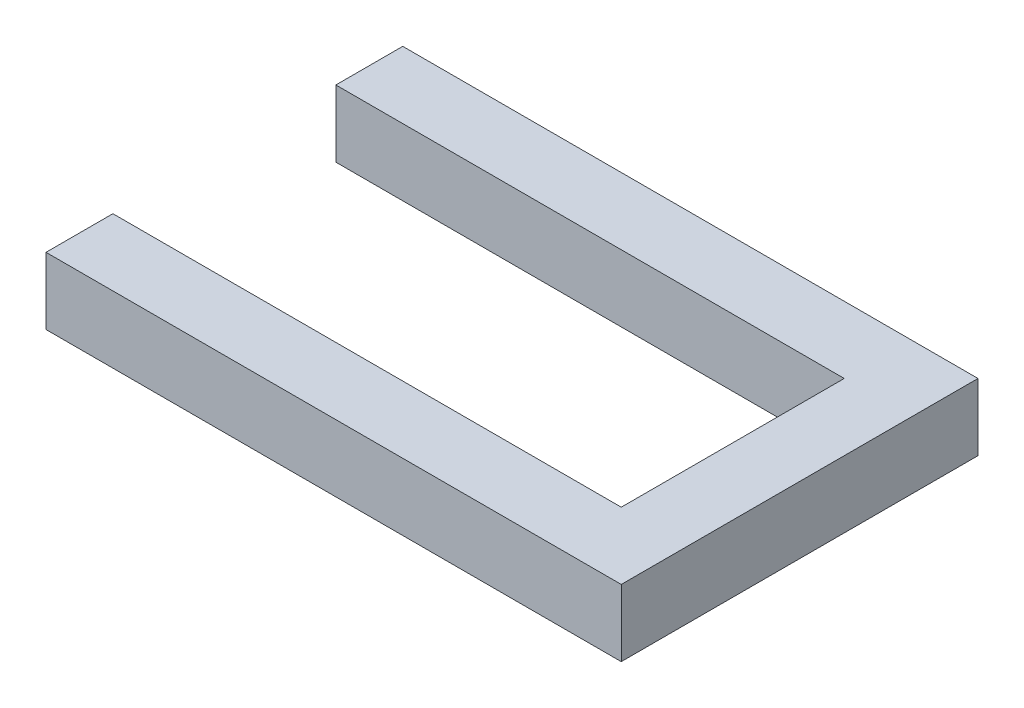
from build123d import *

# Parameters (mm, degrees)
BOSS_EXTRUDE1_DEPTH      = 101.6
BOSS_EXTRUDE1_DEPTH_BACK = 101.6
SKETCH1_W                = 38.1
SKETCH1_H                = 38.1
SKETCH2_W                = 38.1
SKETCH2_H                = 38.1
BOSS_EXTRUDE2_DEPTH      = 289.56


with BuildPart() as part:
    # Sketch1 → Boss-Extrude1 (new, two sides: drawn at the far end of the back side and taken through both)
    with BuildSketch(Plane.XY.offset(-BOSS_EXTRUDE1_DEPTH_BACK)):
        with Locations((-107.95, -12.7)):
            Rectangle(SKETCH1_W, SKETCH1_H)
    extrude(amount=BOSS_EXTRUDE1_DEPTH + BOSS_EXTRUDE1_DEPTH_BACK)

    # Sketch2 → Boss-Extrude2 (add)
    with BuildSketch(Plane.ZY.offset(127)):
        with Locations((82.55, -12.7)):
            Rectangle(SKETCH2_W, SKETCH2_H)
        with Locations((-82.55, -12.7)):
            Rectangle(SKETCH2_W, SKETCH2_H)
    extrude(amount=BOSS_EXTRUDE2_DEPTH)


solid = part.part
